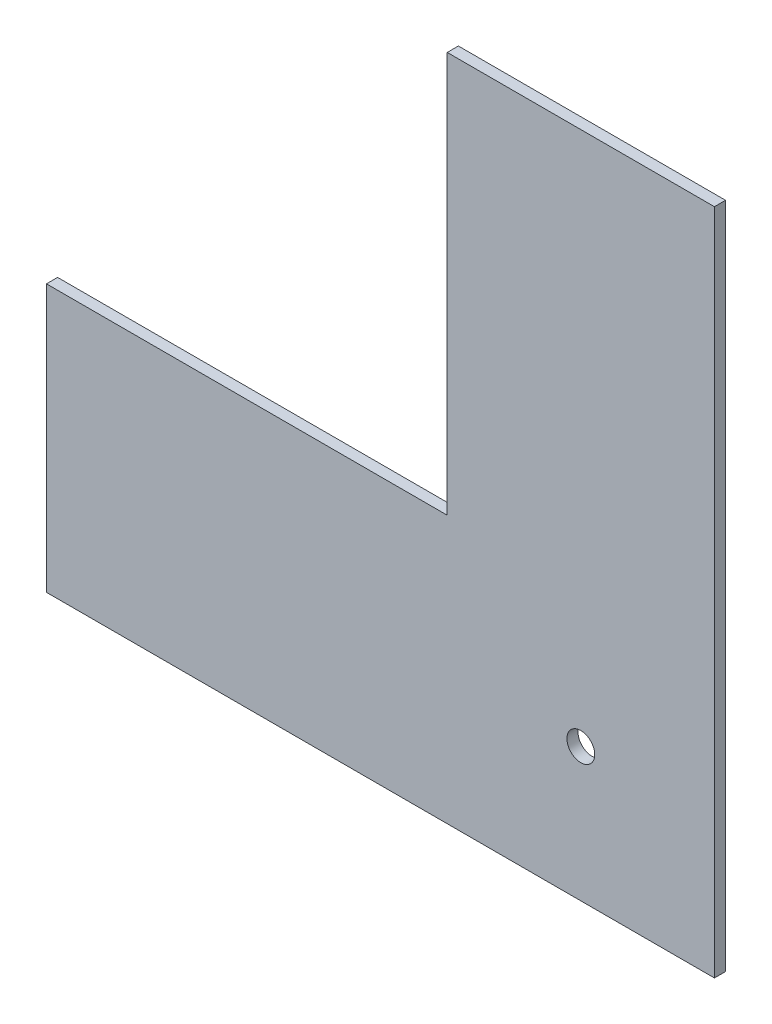
from build123d import *

# Parameters (mm, degrees)
EXTRUDE_1_DEPTH    = 1
HOLE_WIZARD_M3_1_D = 2.5


with BuildPart() as part:
    # 草图1 → 凸台-拉伸1 (new body)
    with BuildSketch(Plane.XY):
        Polygon((-14.909090909, 0), (21.090909091, 0), (21.090909091, 36), (45.090909091, 36), (45.090909091, -24), (-14.909090909, -24), align=None)
    extrude(amount=EXTRUDE_1_DEPTH)

    # M3 螺纹孔的螺纹孔钻头1 (through all)
    with Locations(Plane(origin=(33.090909091, -12, 1), x_dir=(1, 0, 0), z_dir=(0, 0, 1))):
        with Locations((0, 0)):
            Hole(HOLE_WIZARD_M3_1_D / 2)


solid = part.part
